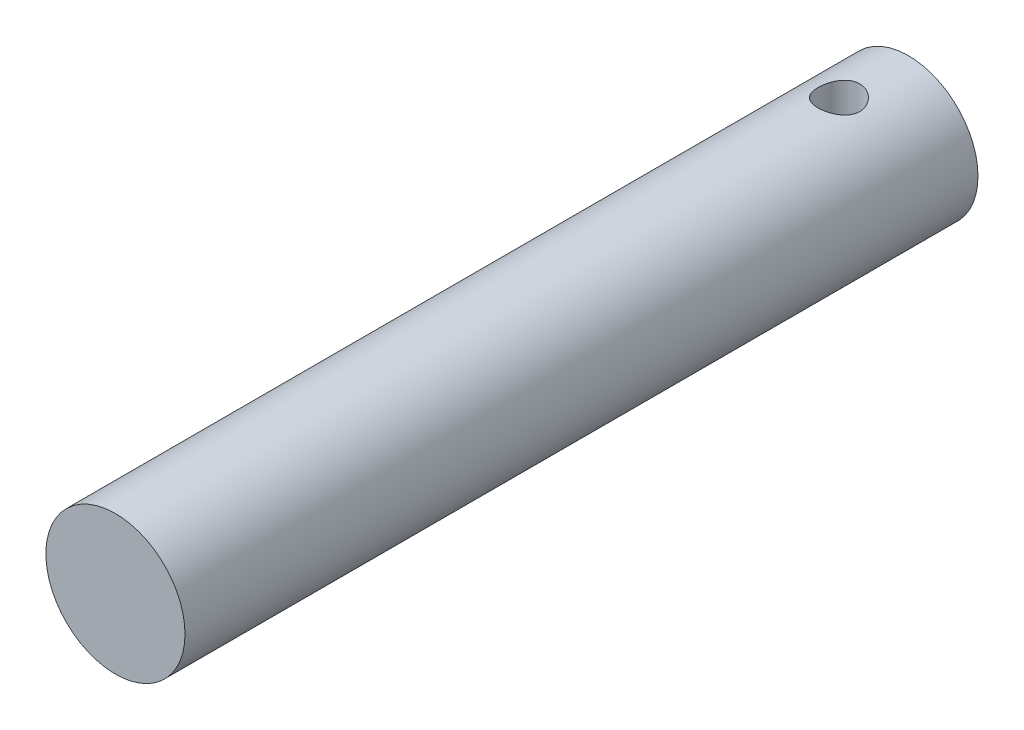
from build123d import *

# Parameters (mm, degrees)
SKETCH2_R               = 5
BOSS_EXTRUDE1_DEPTH     = 28.5
CUT_EXTRUDE1_DEPTH      = 30.36409372
CUT_EXTRUDE1_DEPTH_BACK = 30.36409372
SKETCH3_R               = 1.5


with BuildPart() as part:
    # Sketch2 → Boss-Extrude1 (new, symmetric)
    with BuildSketch(Plane.XY):
        with Locations(Location((0, 0, 0), (0, 0, 180))):
            Circle(SKETCH2_R)
    extrude(amount=BOSS_EXTRUDE1_DEPTH, both=True)

    # Sketch3 → Cut-Extrude1 (cut, two sides: drawn at the far end of the back side and taken through both)
    with BuildSketch(Plane(origin=(0, 0, 0), x_dir=(1, 0, 0), z_dir=(0, 1, 0)).offset(-CUT_EXTRUDE1_DEPTH_BACK)):
        with Locations(Location((0, 23.5, 0), (0, 0, 270))):
            Circle(SKETCH3_R)
    extrude(amount=CUT_EXTRUDE1_DEPTH + CUT_EXTRUDE1_DEPTH_BACK, mode=Mode.SUBTRACT)


solid = part.part
